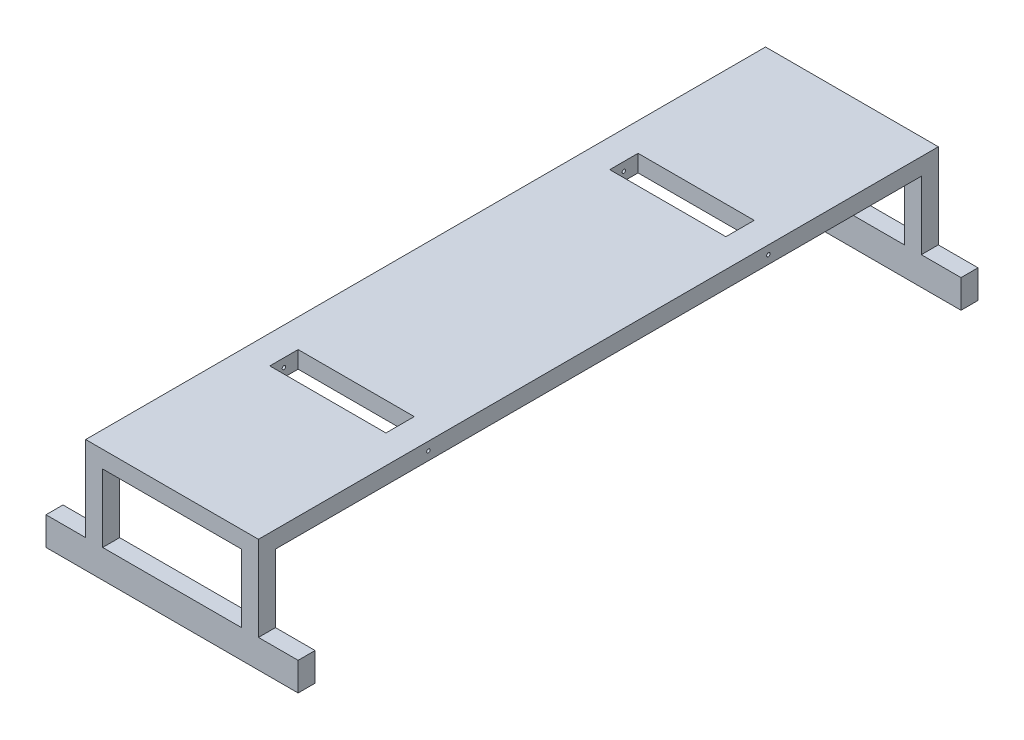
from build123d import *

# Parameters (mm, degrees)
BOSS_EXTRUDE1_DEPTH     = 1200
BOSS_EXTRUDE2_DEPTH     = 1200
CUT_EXTRUDE1_DEPTH      = 1230.636633319
CUT_EXTRUDE1_DEPTH_BACK = 1230.636633319
SKETCH2_W               = 1140
SKETCH2_H               = 120
CUT_EXTRUDE3_DEPTH      = 1230.636633319
SKETCH4_W               = 205
SKETCH4_H               = 50
CUT_EXTRUDE4_DEPTH      = 1230.636633319
CUT_EXTRUDE5_DEPTH      = 1230.636633319
CUT_EXTRUDE5_DEPTH_BACK = 1230.636633319
SKETCH5_R               = 3.05


with BuildPart() as part:
    # Sketch1 → Boss-Extrude1 (new body)
    with BuildSketch(Plane.XY):
        Polygon((-222.5, -50), (222.5, -50), (222.5, 0), (152.5, 0), (122.5, 0), (-122.5, 0), (-152.5, 0), (-222.5, 0), align=None)
    extrude(amount=BOSS_EXTRUDE1_DEPTH)

    # Sketch1<3> → Boss-Extrude2 (add)
    with BuildSketch(Plane.XY):
        Polygon((122.5, 0), (152.5, 0), (152.5, 150), (-152.5, 150), (-152.5, 0), (-122.5, 0), (-122.5, 120), (122.5, 120), align=None)
    extrude(amount=BOSS_EXTRUDE2_DEPTH)

    # Sketch2 → Cut-Extrude1 (cut, two sides: drawn at the far end of the back side and taken through both)
    with BuildSketch(Plane(origin=(0, 0, 0), x_dir=(0, 0, -1), z_dir=(1, 0, 0)).offset(-CUT_EXTRUDE1_DEPTH_BACK)):
        with Locations((-600, 60)):
            Rectangle(SKETCH2_W, SKETCH2_H)
    extrude(amount=CUT_EXTRUDE1_DEPTH + CUT_EXTRUDE1_DEPTH_BACK, mode=Mode.SUBTRACT)

    # Sketch3 → Cut-Extrude3 (cut, through all)
    with BuildSketch(Plane(origin=(0, 0, 0), x_dir=(1, 0, 0), z_dir=(0, 1, 0))):
        Polygon((-152.5, -30), (-222.5, -30), (-222.5, -1170), (-152.5, -1170), (152.5, -1170), (222.5, -1170), (222.5, -30), (152.5, -30), align=None)
    extrude(amount=-CUT_EXTRUDE3_DEPTH, mode=Mode.SUBTRACT)

    # Sketch4 → Cut-Extrude4 (cut, through all)
    with BuildSketch(Plane(origin=(0, 0, 0), x_dir=(1, 0, 0), z_dir=(0, 1, 0))):
        with Locations((0, -900)):
            Rectangle(SKETCH4_W, SKETCH4_H)
        with Locations((0, -300)):
            Rectangle(SKETCH4_W, SKETCH4_H)
    extrude(amount=CUT_EXTRUDE4_DEPTH, mode=Mode.SUBTRACT)

    # Sketch5 → Cut-Extrude5 (cut, two sides: drawn at the far end of the back side and taken through both)
    with BuildSketch(Plane(origin=(0, 0, 0), x_dir=(0, 0, -1), z_dir=(1, 0, 0)).offset(-CUT_EXTRUDE5_DEPTH_BACK)):
        with Locations((-900, 135)):
            Circle(SKETCH5_R)
        with Locations((-300, 135)):
            Circle(SKETCH5_R)
    extrude(amount=CUT_EXTRUDE5_DEPTH + CUT_EXTRUDE5_DEPTH_BACK, mode=Mode.SUBTRACT)


solid = part.part
